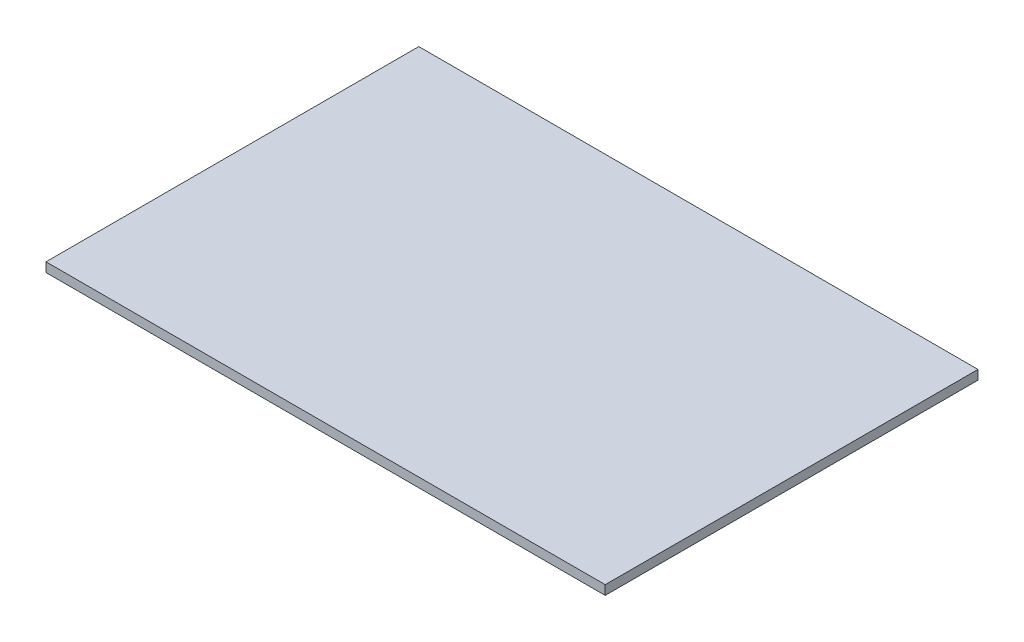
from build123d import *

# Parameters (mm, degrees)
SKETCH1_W           = 3000
SKETCH1_H           = 2000
BOSS_EXTRUDE1_DEPTH = 50


with BuildPart() as part:
    # Sketch1 → Boss-Extrude1 (new body)
    with BuildSketch(Plane(origin=(0, 0, 0), x_dir=(1, 0, 0), z_dir=(0, 1, 0))):
        Rectangle(SKETCH1_W, SKETCH1_H)
    extrude(amount=BOSS_EXTRUDE1_DEPTH)


solid = part.part
